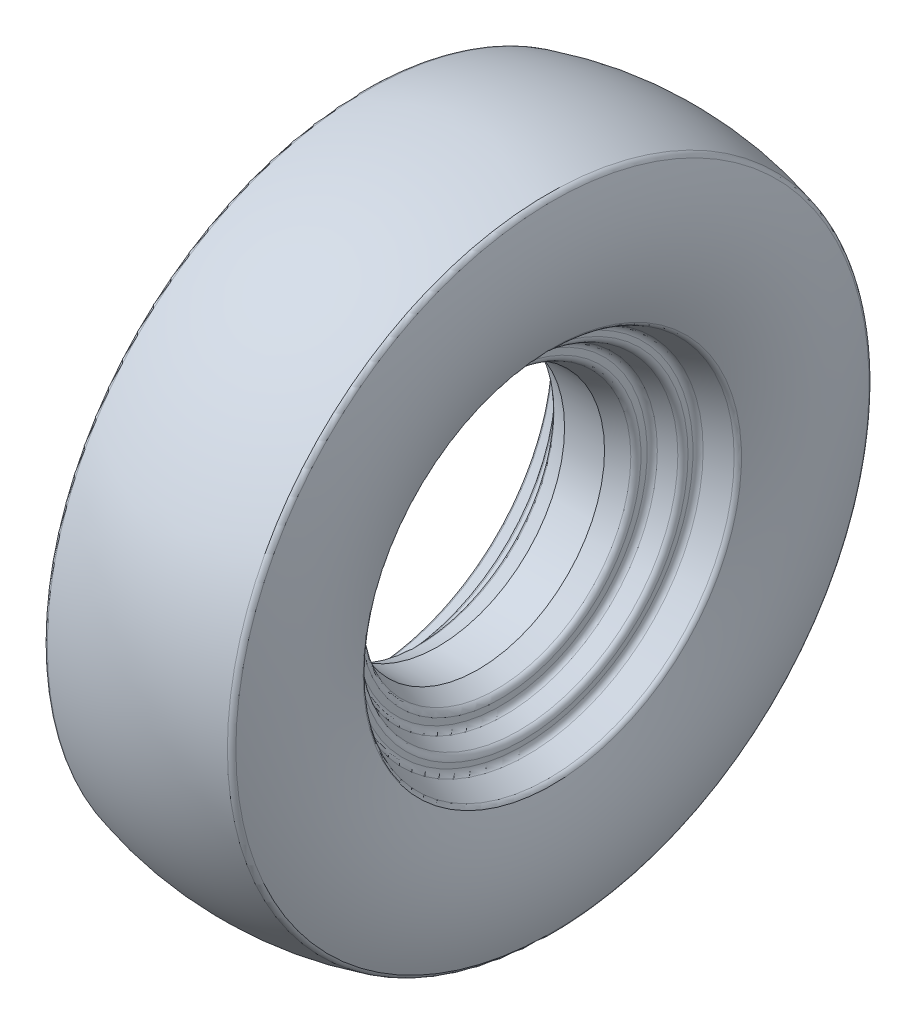
from build123d import *

# Parameters (mm, degrees)
REDONDEO1_R = 5
REDONDEO2_R = 5


with BuildPart() as part:
    # Croquis1 → Revolución1 (revolve)
    with BuildSketch(Plane(origin=(0, 0, 0), x_dir=(1, 0, 0), z_dir=(0, 1, 0))):
        with BuildLine():
            Line((0, 250), (0, 95))
            Line((0, 95), (15, 95))
            Line((15, 95), (31.868809424, 102.180137863))
            Line((31.868809424, 102.180137863), (31.868809424, 113.430137863))
            Line((31.868809424, 113.430137863), (48.737618848, 120.610275725))
            Line((48.737618848, 120.610275725), (48.737618848, 130.932753785))
            Line((48.737618848, 130.932753785), (70.03994637, 140))
            add(Edge.make_bspline(
                [(70, 240), (89.98002387, 190.007667827), (70.03994637, 140)],
                knots=[0, 0, 0, 1, 1, 1], degree=2))
            ThreePointArc((70, 240), (35.355339059, 247.487373415), (0, 250))
        make_face()
    revolve(axis=Axis((-111.970451678, 0, 0), (1, 0, 0)))

    # Redondeo1
    redondeo1_edges = [part.edges().sort_by_distance(p)[0] for p in [
        (31.868809424, 0, 102.180137863),
        (48.737618848, 0, 120.610275725),
        (70.03994637, 0, 140),
        (70, 0, 240),
    ]]
    fillet(redondeo1_edges, radius=REDONDEO1_R)

    # Redondeo2
    redondeo2_edges = [part.edges().sort_by_distance(p)[0] for p in [
        (31.868809424, 0, 113.430137863),
        (48.737618848, 0, 130.932753785),
    ]]
    fillet(redondeo2_edges, radius=REDONDEO2_R)

    # Simetría1: part across plane


with BuildPart() as part_1:
    add(part.part)
    add(part.part.mirror(Plane(origin=(0, 0, -250), x_dir=(0, 0, 1), z_dir=(1, 0, 0))))


solid = part_1.part
